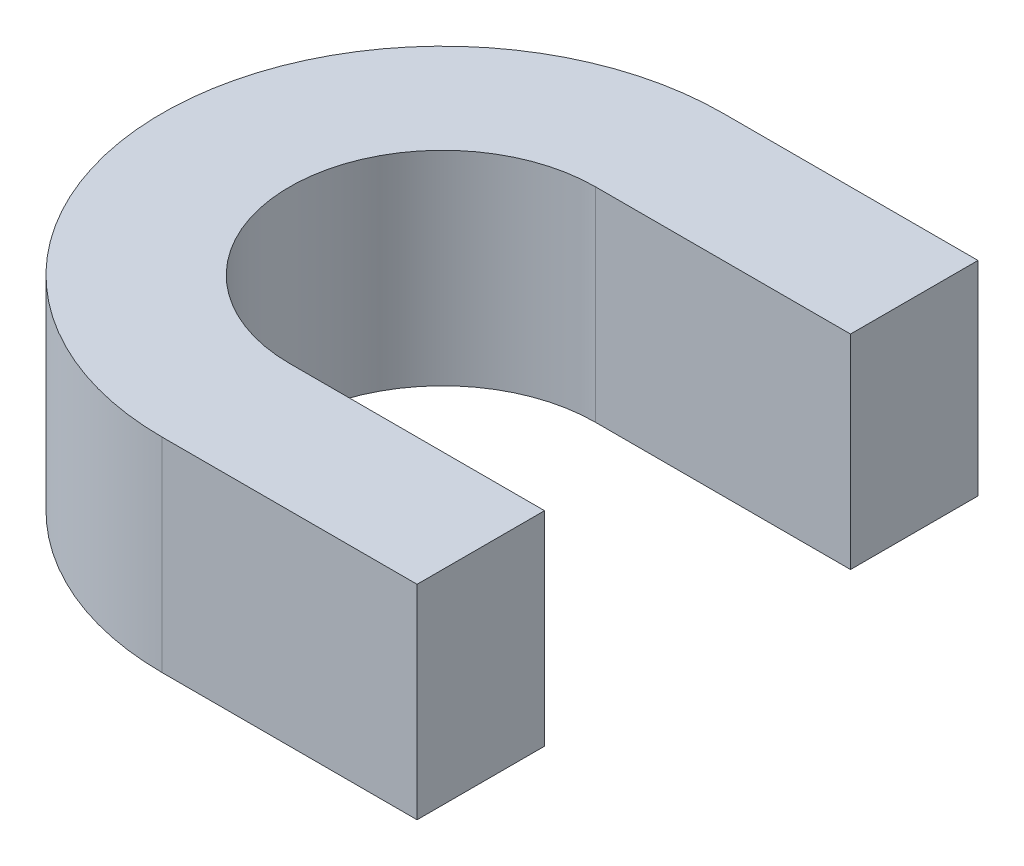
from build123d import *

# Parameters (mm, degrees)
BOSS_EXTRUDE1_DEPTH = 8


with BuildPart() as part:
    # Sketch1 → Boss-Extrude1 (new body)
    with BuildSketch(Plane(origin=(0, 0, 0), x_dir=(1, 0, 0), z_dir=(0, 1, 0))):
        with BuildLine():
            Line((0, 11), (10, 11))
            Line((10, 11), (10, 6))
            Line((10, 6), (0, 6))
            ThreePointArc((0, 6), (-6, 0), (0, -6))
            Line((0, -6), (10, -6))
            Line((10, -6), (10, -11))
            Line((10, -11), (0, -11))
            ThreePointArc((0, -11), (-11, 0), (0, 11))
        make_face()
    extrude(amount=BOSS_EXTRUDE1_DEPTH)


solid = part.part
